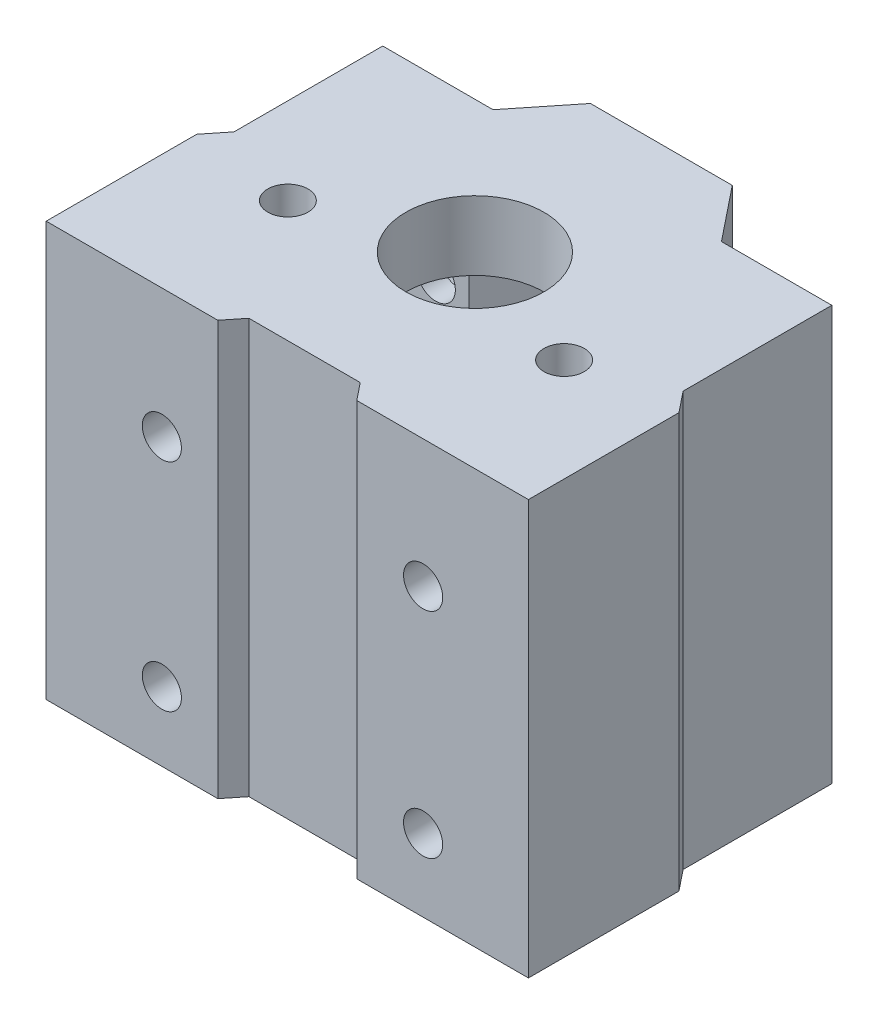
from build123d import *

# Parameters (mm, degrees)
SKETCH2_R                    = 6
BOSS_EXTRUDE1_DEPTH          = 6
BOSS_EXTRUDE2_DEPTH          = 30
CUT_EXTRUDE1_DEPTH           = 47.38051854
CUT_EXTRUDE1_DEPTH_BACK      = 47.38051854
SKETCH3_R                    = 1.7
SKETCH4_R                    = 2.75
CUT_EXTRUDE2_DEPTH           = 2
CUT_EXTRUDE2_OTHER_WAY_DEPTH = 10
CUT_EXTRUDE2_OTHER_WAY_TAPER = -11
CUT_EXTRUDE3_DEPTH           = 45.727983411
CUT_EXTRUDE3_DEPTH_BACK      = 45.727983411
SKETCH6_R                    = 1.75
SKETCH7_R                    = 3.25
CUT_EXTRUDE4_DEPTH           = 2


with BuildPart() as part:
    # Sketch2 → Boss-Extrude1 (new body)
    with BuildSketch(Plane(origin=(0, 0, 0), x_dir=(1, 0, 0), z_dir=(0, 1, 0))):
        Polygon((-6.162811814, 16.2), (-9.922811814, 11.5), (-19.51, 11.5), (-19.51, -1.421485233), (-20.95, -3.221485233), (-20.95, -16.3), (-6.037188186, -16.3), (-4.837188186, -14.8), (4.837188186, -14.8), (6.037188186, -16.3), (20.95, -16.3), (20.95, -3.221485233), (19.51, -1.421485233), (19.51, 11.5), (9.922811814, 11.5), (6.162811814, 16.2), align=None)
        with Locations(Location((0, 0, 0), (0, 0, 270))):
            Circle(SKETCH2_R, mode=Mode.SUBTRACT)
    extrude(amount=BOSS_EXTRUDE1_DEPTH)

    # Sketch2<3> → Boss-Extrude2 (add)
    with BuildSketch(Plane(origin=(0, 0, 0), x_dir=(1, 0, 0), z_dir=(0, 1, 0))):
        Polygon((9.922811814, 11.5), (6.162811814, 16.2), (-6.162811814, 16.2), (-9.922811814, 11.5), (-19.51, 11.5), (-19.51, -1.421485233), (-20.95, -3.221485233), (-20.95, -16.3), (-6.037188186, -16.3), (-4.837188186, -14.8), (4.837188186, -14.8), (6.037188186, -16.3), (20.95, -16.3), (20.95, -3.221485233), (19.51, -1.421485233), (19.51, 11.5), align=None)
        Polygon((4.240312424, 12.2), (-4.240312424, 12.2), (-8.000312424, 7.5), (-15.51, 7.5), (-15.51, -2.82460947), (-16.95, -4.62460947), (-16.95, -12.3), (-7.959687576, -12.3), (-6.759687576, -10.8), (6.759687576, -10.8), (7.959687576, -12.3), (16.95, -12.3), (16.95, -4.62460947), (15.51, -2.82460947), (15.51, 7.5), (8.000312424, 7.5), align=None, mode=Mode.SUBTRACT)
    extrude(amount=-BOSS_EXTRUDE2_DEPTH)

    # Sketch3 → Cut-Extrude1 (cut, two sides: drawn at the far end of the back side and taken through both)
    with BuildSketch(Plane(origin=(0, 0, 12.3), x_dir=(-1, 0, 0), z_dir=(0, 0, -1)).offset(-CUT_EXTRUDE1_DEPTH_BACK)):
        with Locations((10.9, -5.2)):
            Circle(SKETCH3_R)
        with Locations((10.9, -24)):
            Circle(SKETCH3_R)
        with Locations((-11.8, -23.7)):
            Circle(SKETCH3_R)
        with Locations((-11.8, -5.1)):
            Circle(SKETCH3_R)
    extrude(amount=CUT_EXTRUDE1_DEPTH + CUT_EXTRUDE1_DEPTH_BACK, mode=Mode.SUBTRACT)

    # Sketch4 → Cut-Extrude2 (cut)
    with BuildSketch(Plane(origin=(0, 0, -11.5), x_dir=(-1, 0, 0), z_dir=(0, 0, -1))):
        with Locations((-11.8, -5.1)):
            Circle(SKETCH4_R)
        with Locations((10.9, -5.2)):
            Circle(SKETCH4_R)
        with Locations((-11.8, -23.7)):
            Circle(SKETCH4_R)
        with Locations((10.9, -24)):
            Circle(SKETCH4_R)
    extrude(amount=-CUT_EXTRUDE2_DEPTH, mode=Mode.SUBTRACT)

    # Sketch4 → Cut-Extrude2 other way (cut)
    with BuildSketch(Plane(origin=(0, 0, -11.5), x_dir=(-1, 0, 0), z_dir=(0, 0, -1))):
        with Locations((-11.8, -5.1)):
            Circle(SKETCH4_R)
        with Locations((10.9, -5.2)):
            Circle(SKETCH4_R)
        with Locations((-11.8, -23.7)):
            Circle(SKETCH4_R)
        with Locations((10.9, -24)):
            Circle(SKETCH4_R)
    extrude(amount=CUT_EXTRUDE2_OTHER_WAY_DEPTH, taper=CUT_EXTRUDE2_OTHER_WAY_TAPER, mode=Mode.SUBTRACT)

    # Sketch6 → Cut-Extrude3 (cut, two sides: drawn at the far end of the back side and taken through both)
    with BuildSketch(Plane(origin=(0, 6, 0), x_dir=(1, 0, 0), z_dir=(0, 1, 0)).offset(-CUT_EXTRUDE3_DEPTH_BACK)):
        with Locations(Location((-12, -4.25, 0), (0, 0, 270))):
            Circle(SKETCH6_R)
        with Locations(Location((12, -4.25, 0), (0, 0, 270))):
            Circle(SKETCH6_R)
    extrude(amount=CUT_EXTRUDE3_DEPTH + CUT_EXTRUDE3_DEPTH_BACK, mode=Mode.SUBTRACT)

    # Sketch7 → Cut-Extrude4 (cut)
    with BuildSketch(Plane.XZ):
        with Locations(Location((-12, 4.25, 0), (0, 0, 270))):
            Circle(SKETCH7_R)
        with Locations(Location((12, 4.25, 0), (0, 0, 270))):
            Circle(SKETCH7_R)
    extrude(amount=-CUT_EXTRUDE4_DEPTH, mode=Mode.SUBTRACT)


solid = part.part
